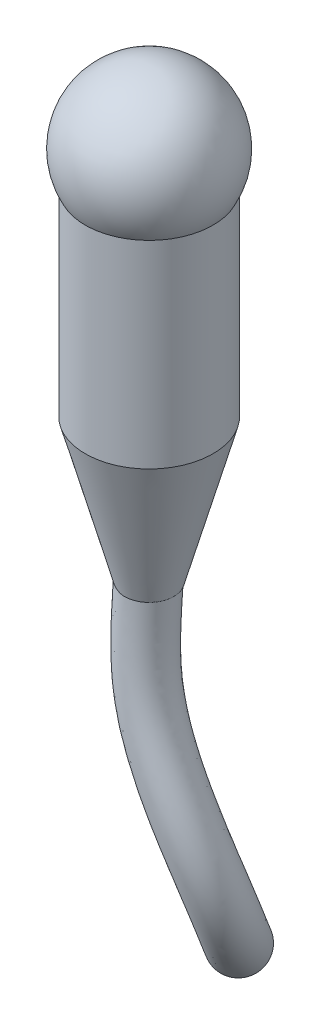
from build123d import *

# Parameters (mm, degrees)
SWEEP1_PROFILE_R = 3


with BuildPart() as part:
    # Sketch1 → Revolve1 (revolve)
    with BuildSketch(Plane.XY, mode=Mode.PRIVATE) as revolve1_sk:
        with BuildLine():
            Line((-7.75, 54.212646434), (-7.75, 30.212646434))
            Line((-7.75, 30.212646434), (-3, 12.850690899))
            Line((-3, 12.850690899), (0, 12.850690899))
            Line((0, 12.850690899), (0, 67.181279304))
            ThreePointArc((0, 67.181279304), (-7.553938352, 62.895480825), (-7.75, 54.212646434))
        make_face()
    revolve(revolve1_sk.sketch.rotate(Axis((0, 0, 0), (0, 1, 0)), 270), axis=Axis((0, 0, 0), (0, 1, 0)))

    # Sweep1: sweep along a curve in space
    with BuildLine() as sweep1_path:
        add(Edge.make_bspline(
            [(4.757150603, -25.7366262, -6.087195701), (5.627758214, -24.44447883, -5.038923783), (6.326435868, -23.022325912, -4.069859604), (6.91492029, -20.582851477, -2.765872435), (7.025810676, -19.745186706, -2.371479313), (7.073525311, -18.026427041, -1.663857917), (7.008307419, -17.134667314, -1.347536733), (6.588256268, -14.483444971, -0.53932608), (6.020824588, -12.741751031, -0.177979953), (4.663105328, -9.286277523, 0.322088757), (3.881663348, -7.590246514, 0.45841315), (2.383852026, -4.174742003, 0.595391257), (1.665016873, -2.456050286, 0.594538606), (0.529903449, 1.081541048, 0.510445474), (0.142072783, 2.909765759, 0.425502373), (-0.235341403, 6.696751388, 0.232326759), (-0.25197438, 8.621859122, 0.126547871), (-0.164669136, 12.443553865, -0.01342884), (-0.059465227, 14.354537371, -0.048880755), (0, 16.268330958, 0)],
            knots=[0, 0, 0, 0, 0.125, 0.125, 0.1875, 0.1875, 0.25, 0.25, 0.375, 0.375, 0.5, 0.5, 0.625, 0.625, 0.75, 0.75, 0.875, 0.875, 1, 1, 1, 1], degree=3))
    # Sweep1 profile (on start of the path) → Sweep1 (sweep)
    with BuildSketch(Plane(origin=(4.757150603, -25.7366262, -6.087195701), x_dir=(0, -0.6300140142468761, 0.7765837635777205), z_dir=(0.4636091144869047, 0.6880841496379605, 0.5582175131448969))):
        Circle(SWEEP1_PROFILE_R)
    sweep(path=sweep1_path.line)


solid = part.part
